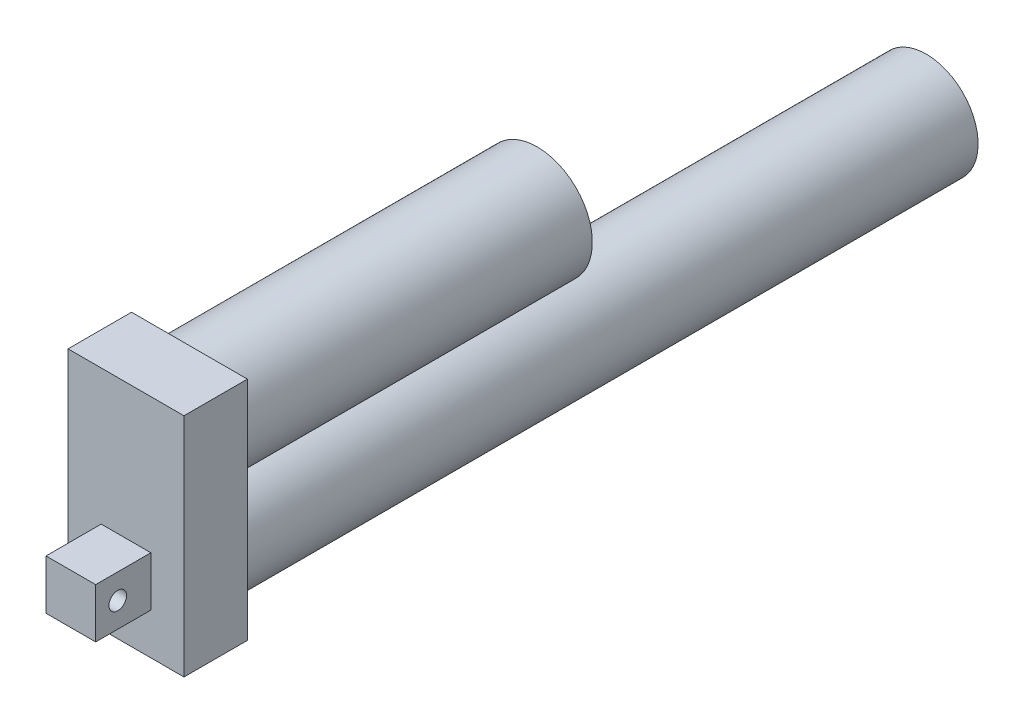
from build123d import *

# Parameters (mm, degrees)
SKETCH1_W           = 42
SKETCH1_H           = 82
BOSS_EXTRUDE1_DEPTH = 23
SKETCH2_W           = 18
SKETCH2_H           = 18
BOSS_EXTRUDE2_DEPTH = 20
SKETCH3_R           = 3.2
CUT_EXTRUDE1_DEPTH  = 21
SKETCH4_R           = 18.8
BOSS_EXTRUDE3_DEPTH = 267
SKETCH5_R           = 20
BOSS_EXTRUDE4_DEPTH = 126
SKETCH6_R           = 10
CUT_EXTRUDE2_DEPTH  = 20
SKETCH7_R           = 14
CUT_EXTRUDE5_DEPTH  = 247


with BuildPart() as part:
    # Sketch1 → Boss-Extrude1 (new body)
    with BuildSketch(Plane.XY):
        Rectangle(SKETCH1_W, SKETCH1_H)
    extrude(amount=BOSS_EXTRUDE1_DEPTH)

    # Sketch2 → Boss-Extrude2 (add)
    with BuildSketch(Plane.XY.offset(23)):
        with Locations((0, -17)):
            Rectangle(SKETCH2_W, SKETCH2_H)
    extrude(amount=BOSS_EXTRUDE2_DEPTH)

    # Sketch3 → Cut-Extrude1 (cut)
    with BuildSketch(Plane(origin=(9, 0, 0), x_dir=(0, 0, -1), z_dir=(1, 0, 0))):
        with Locations(Location((-35, -17, 0), (0, 0, 90))):
            Circle(SKETCH3_R)
    extrude(amount=-CUT_EXTRUDE1_DEPTH, mode=Mode.SUBTRACT)

    # Sketch4 → Boss-Extrude3 (add)
    with BuildSketch(Plane(origin=(0, 0, 0), x_dir=(-1, 0, 0), z_dir=(0, 0, -1))):
        with Locations((0, -19.778983504)):
            Circle(SKETCH4_R)
    extrude(amount=BOSS_EXTRUDE3_DEPTH)

    # Sketch5 → Boss-Extrude4 (add)
    with BuildSketch(Plane(origin=(0, 0, 0), x_dir=(-1, 0, 0), z_dir=(0, 0, -1))):
        with Locations((0, 20.401687075)):
            Circle(SKETCH5_R)
    extrude(amount=BOSS_EXTRUDE4_DEPTH)

    # Sketch6 → Cut-Extrude2 (cut)
    with BuildSketch(Plane(origin=(0, 0, -267), x_dir=(-1, 0, 0), z_dir=(0, 0, -1))):
        with Locations((0, -19.778983504)):
            Circle(SKETCH6_R)
    extrude(amount=-CUT_EXTRUDE2_DEPTH, mode=Mode.SUBTRACT)

    # Sketch7 → Cut-Extrude5 (cut)
    with BuildSketch(Plane(origin=(0, 0, -247), x_dir=(-1, 0, 0), z_dir=(0, 0, -1))):
        with Locations((0, -19.778983504)):
            Circle(SKETCH7_R)
    extrude(amount=-CUT_EXTRUDE5_DEPTH, mode=Mode.SUBTRACT)


solid = part.part
